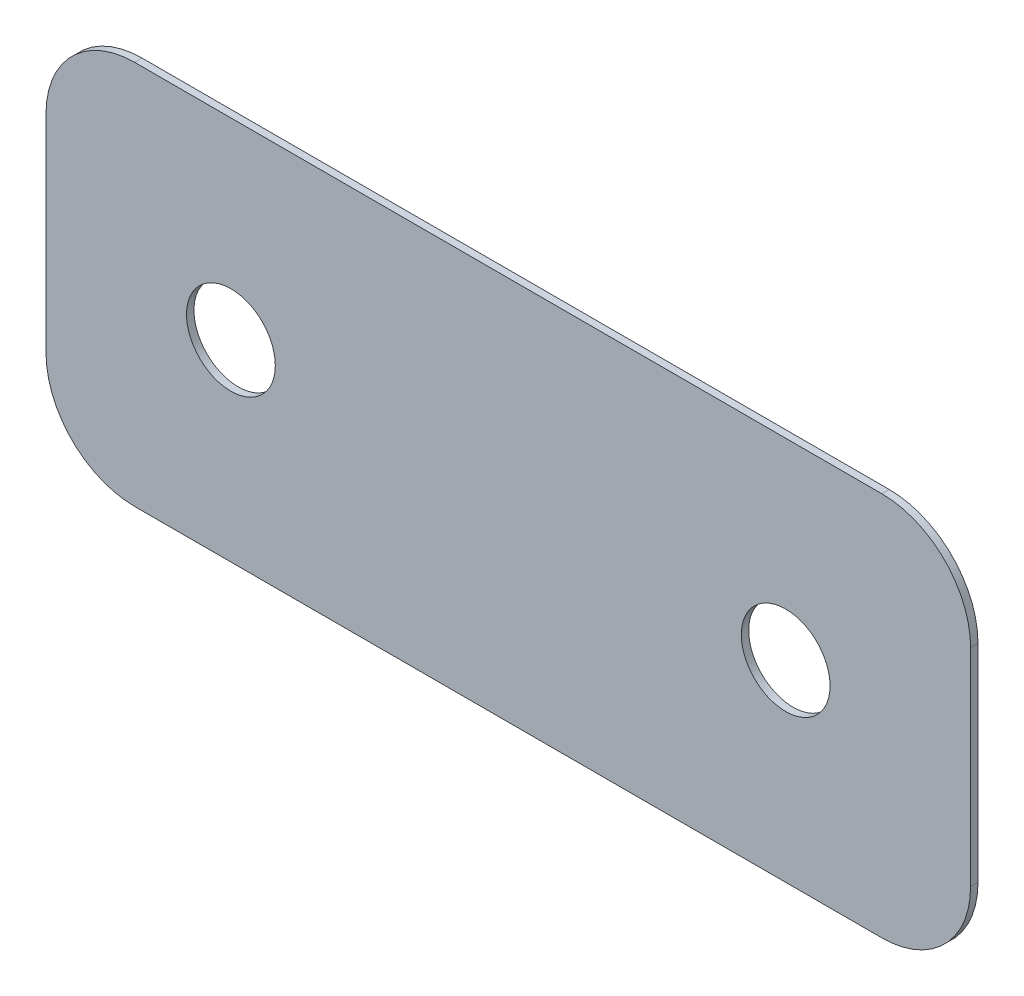
from build123d import *

# Parameters (mm, degrees)
SKETCH1_R           = 6
BOSS_EXTRUDE1_DEPTH = 1


with BuildPart() as part:
    # Sketch1 → Boss-Extrude1 (new body)
    with BuildSketch(Plane.XY):
        with BuildLine():
            Line((-50.5, 26), (50.5, 26))
            ThreePointArc((50.5, 26), (58.985281374, 22.485281374), (62.5, 14))
            Line((62.5, 14), (62.5, -14))
            ThreePointArc((62.5, -14), (58.985281374, -22.485281374), (50.5, -26))
            Line((50.5, -26), (-50.5, -26))
            ThreePointArc((-50.5, -26), (-58.985281374, -22.485281374), (-62.5, -14))
            Line((-62.5, -14), (-62.5, 14))
            ThreePointArc((-62.5, 14), (-58.985281374, 22.485281374), (-50.5, 26))
        make_face()
        with Locations((-37.5, 0)):
            Circle(SKETCH1_R, mode=Mode.SUBTRACT)
        with Locations((37.5, 0)):
            Circle(SKETCH1_R, mode=Mode.SUBTRACT)
    extrude(amount=BOSS_EXTRUDE1_DEPTH)


solid = part.part
